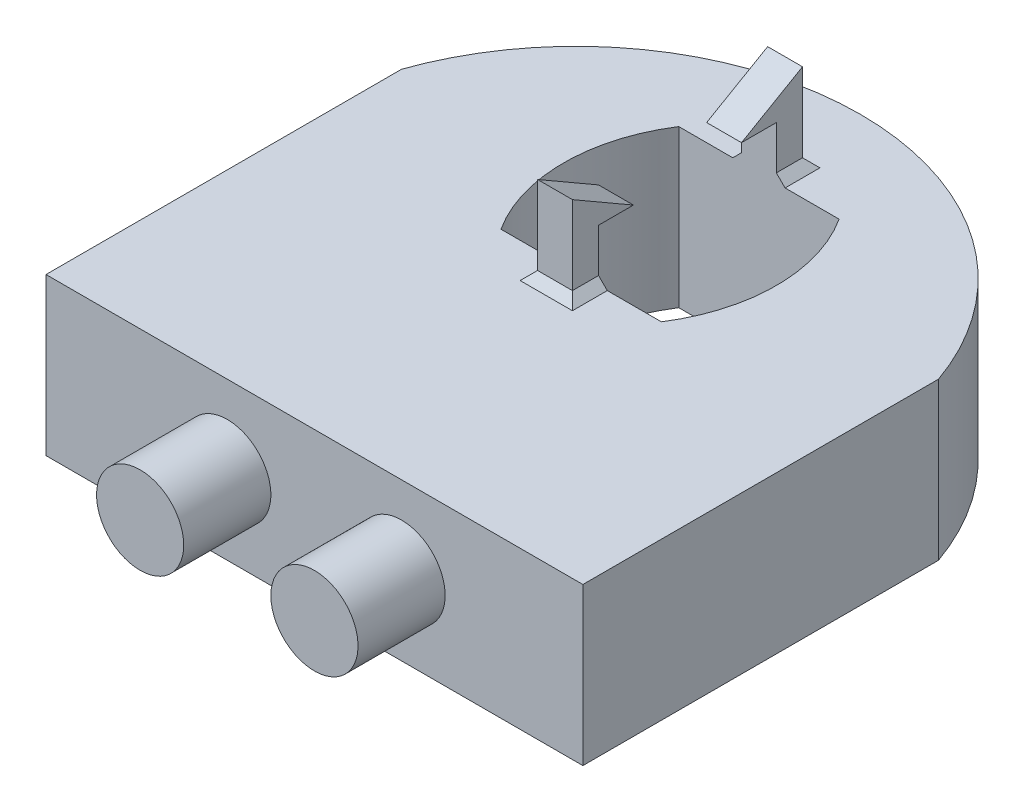
from build123d import *

# Parameters (mm, degrees)
BOSS_EXTRUDE1_DEPTH = 9
BOSS_EXTRUDE4_DEPTH = 1
SKETCH2_R           = 2.5
BOSS_EXTRUDE2_DEPTH = 5
CHAMFER2_SIZE       = 0.5


with BuildPart() as part:
    # Sketch1 → Boss-Extrude1 (new body)
    with BuildSketch(Plane(origin=(0, 0, 0), x_dir=(1, 0, 0), z_dir=(0, 1, 0))):
        with BuildLine():
            Line((0, 20.4), (0, 0))
            Line((0, 0), (30.8, 0))
            Line((30.8, 0), (30.8, 20.4))
            ThreePointArc((30.8, 20.4), (15.4, 31.319313711), (0, 20.4))
        make_face()
        with BuildLine():
            ThreePointArc((10.8, 15.3), (9.3, 20.4), (10.8, 25.5))
            Line((10.8, 25.5), (20, 25.5))
            ThreePointArc((20, 25.5), (21.5, 20.4), (20, 15.3))
            Line((20, 15.3), (10.8, 15.3))
        make_face(mode=Mode.SUBTRACT)
    extrude(amount=BOSS_EXTRUDE1_DEPTH)

    # Sketch6 → Boss-Extrude4 (add, symmetric)
    with BuildSketch(Plane(origin=(15.4, 0, 0), x_dir=(0, 0, -1), z_dir=(1, 0, 0))):
        Polygon((15.3, 9), (15.3, 12), (17.3, 12), (13.8, 14.020725942), (13.8, 9), align=None)
        Polygon((25.5, 9), (25.5, 12), (23.5, 12), (27, 14.020725942), (27, 9), align=None)
    extrude(amount=BOSS_EXTRUDE4_DEPTH, both=True)

    # Sketch2 → Boss-Extrude2 (add)
    with BuildSketch(Plane.XY):
        with Locations(Location((10.4, 4.5, 0), (0, 0, 180))):
            Circle(SKETCH2_R)
        with Locations(Location((20.4, 4.5, 0), (0, 0, 180))):
            Circle(SKETCH2_R)
    extrude(amount=BOSS_EXTRUDE2_DEPTH)

    # Chamfer2
    chamfer2_edges = [part.edges().sort_by_distance(p)[0] for p in [
        (14.4, 9, -14.55),
        (15.4, 9, -13.8),
        (16.4, 9, -14.55),
        (14.4, 9, -26.25),
        (15.4, 9, -27),
        (16.4, 9, -26.25),
    ]]
    chamfer(chamfer2_edges, length=CHAMFER2_SIZE)


solid = part.part
